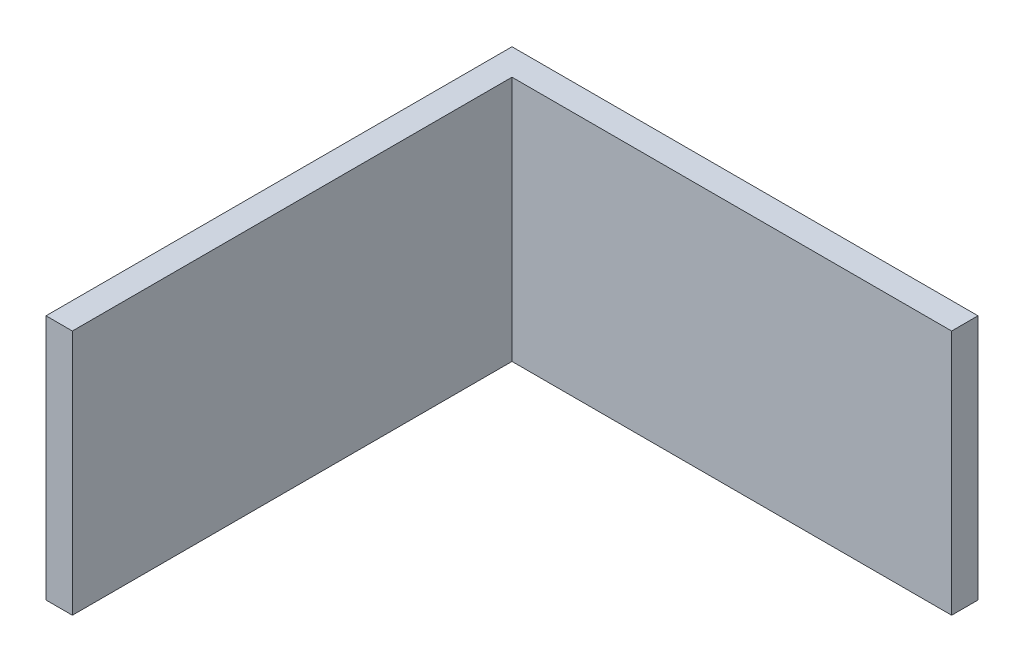
from build123d import *

# Parameters (mm, degrees)
SKETCH1_W           = 26.5
SKETCH1_H           = 14
BOSS_EXTRUDE1_DEPTH = 1.5
SKETCH8_W           = 1.5
SKETCH8_H           = 14
BOSS_EXTRUDE2_DEPTH = 25


with BuildPart() as part:
    # Sketch1 → Boss-Extrude1 (new body)
    with BuildSketch(Plane.XY):
        Rectangle(SKETCH1_W, SKETCH1_H)
    extrude(amount=BOSS_EXTRUDE1_DEPTH)

    # Sketch8 → Boss-Extrude2 (add)
    with BuildSketch(Plane.XY.offset(1.5)):
        with Locations((-12.5, 0)):
            Rectangle(SKETCH8_W, SKETCH8_H)
    extrude(amount=BOSS_EXTRUDE2_DEPTH)


solid = part.part
